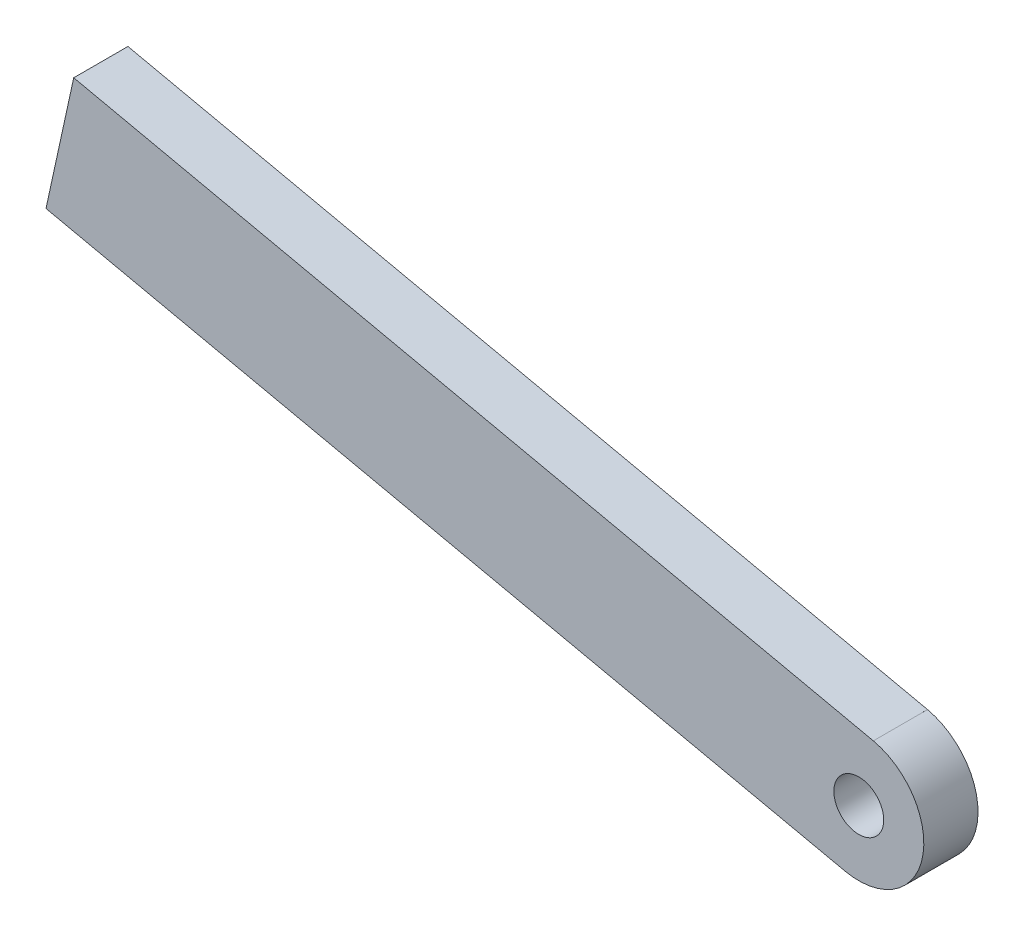
from build123d import *

# Parameters (mm, degrees)
SKETCH2_R           = 3.81
BOSS_EXTRUDE1_DEPTH = 3.175
SKETCH3_R           = 1.4605
CUT_EXTRUDE1_DEPTH  = 3.175


with BuildPart() as part:
    # Sketch2 → Boss-Extrude1 (new body)
    with BuildSketch(Plane.XY):
        with Locations((-193.675, 14.2875)):
            Circle(SKETCH2_R)
        Polygon((-239.6628502, 28.219925218), (-241.287043978, 20.775034718), (-194.44628148, 10.556150371), (-192.822087702, 18.001040872), align=None)
    extrude(amount=BOSS_EXTRUDE1_DEPTH)

    # Sketch3 → Cut-Extrude1 (cut)
    with BuildSketch(Plane.XY.offset(3.175)):
        with Locations((-193.675, 14.2875)):
            Circle(SKETCH3_R)
    extrude(amount=-CUT_EXTRUDE1_DEPTH, mode=Mode.SUBTRACT)


solid = part.part
